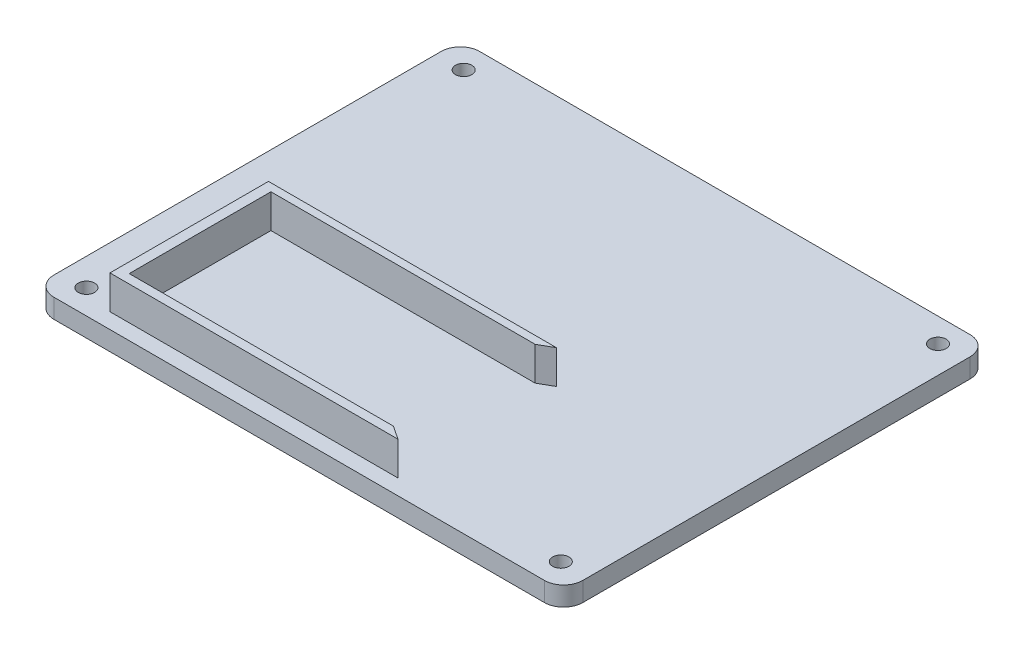
from build123d import *

# Parameters (mm, degrees)
BOSS_EXTRUDE1_DEPTH = 11
SKETCH1_3_R         = 1.7
BOSS_EXTRUDE2_DEPTH = 4


with BuildPart() as part:
    # Sketch1 → Boss-Extrude1 (new body)
    with BuildSketch(Plane(origin=(0, 0, 0), x_dir=(1, 0, 0), z_dir=(0, 1, 0))):
        Polygon((14.535232679, 29.5), (17.346594298, 31.108605337), (-42.592792902, 31.108605337), (-42.592792902, -1.87579117), (17.346594298, -1.87579117), (14.535232679, 0), (-40.464767321, 0), (-40.464767321, 29.5), align=None)
    extrude(amount=BOSS_EXTRUDE1_DEPTH)

    # Sketch1<3> → Boss-Extrude2 (add)
    with BuildSketch(Plane(origin=(0, 0, 0), x_dir=(1, 0, 0), z_dir=(0, 1, 0))):
        with BuildLine():
            Line((55.045, -1.09), (55.045, 79.51))
            ThreePointArc((55.045, 79.51), (53.873427125, 82.338427125), (51.045, 83.51))
            Line((51.045, 83.51), (-51.045, 83.51))
            ThreePointArc((-51.045, 83.51), (-53.873427125, 82.338427125), (-55.045, 79.51))
            Line((-55.045, 79.51), (-55.045, -1.09))
            ThreePointArc((-55.045, -1.09), (-53.873427125, -3.918427125), (-51.045, -5.09))
            Line((-51.045, -5.09), (51.045, -5.09))
            ThreePointArc((51.045, -5.09), (53.873427125, -3.918427125), (55.045, -1.09))
        make_face()
        with Locations((-49.365, 0)):
            Circle(SKETCH1_3_R, mode=Mode.SUBTRACT)
        Polygon((17.346594298, 31.108605337), (14.535232679, 29.5), (-40.464767321, 29.5), (-40.464767321, 0), (14.535232679, 0), (17.346594298, -1.87579117), (-42.592792902, -1.87579117), (-42.592792902, 31.108605337), align=None, mode=Mode.SUBTRACT)
        with Locations((49.365, 0)):
            Circle(SKETCH1_3_R, mode=Mode.SUBTRACT)
        with Locations((-49.365, 78.51)):
            Circle(SKETCH1_3_R, mode=Mode.SUBTRACT)
        with Locations((49.365, 78.51)):
            Circle(SKETCH1_3_R, mode=Mode.SUBTRACT)
    extrude(amount=BOSS_EXTRUDE2_DEPTH)


solid = part.part
